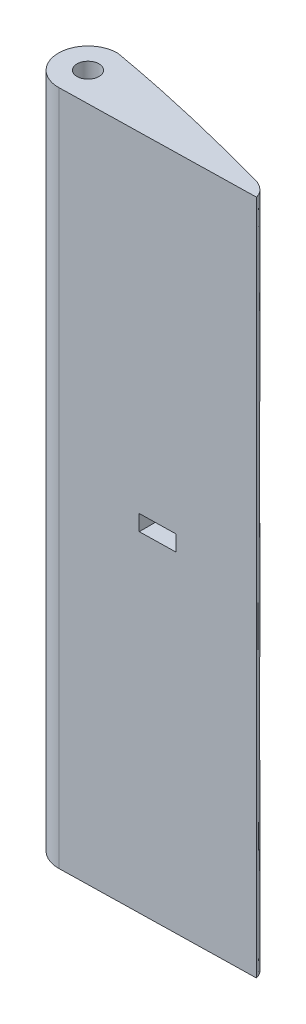
from build123d import *

# Parameters (mm, degrees)
SKETCH1_R           = 1.778
BOSS_EXTRUDE1_DEPTH = 109.22
SKETCH3_W           = 2.921
SKETCH3_H           = 1.27
CUT_EXTRUDE1_DEPTH  = 5.842


with BuildPart() as part:
    # Sketch1 → Boss-Extrude1 (new body)
    with BuildSketch(Plane(origin=(0, 0, 0), x_dir=(1, 0, 0), z_dir=(0, 1, 0))):
        with BuildLine():
            Line((94.902676098, -1.539936949), (126.153699606, -0.905121353))
            add(Edge.make_bspline(
                [(124.23332742, 1.220658438), (125.083825562, 0.793733928), (125.965467473, 0.088202275), (126.153699606, -0.905121353)],
                knots=[0, 0, 0, 0, 1, 1, 1, 1], degree=3))
            add(Edge.make_bspline(
                [(94.805376938, 8.04083585), (104.725661306, 6.284506107), (114.540546966, 3.959935264), (124.23332742, 1.220658438)],
                knots=[0, 0, 0, 0, 1, 1, 1, 1], degree=3))
            ThreePointArc((94.805376938, 8.04083585), (90.01474351, 3.201303292), (94.902676098, -1.539936949))
        make_face()
        with Locations(Location((94.805376938, 3.249955381, 0), (0, 0, 270))):
            Circle(SKETCH1_R, mode=Mode.SUBTRACT)
    extrude(amount=BOSS_EXTRUDE1_DEPTH)

    # Sketch3 → Cut-Extrude1 (cut)
    with BuildSketch(Plane.XY.offset(2.54)):
        with Locations((109.067687852, 55.245)):
            Rectangle(SKETCH3_W, SKETCH3_H)
        with Locations((111.988687852, 55.245)):
            Rectangle(SKETCH3_W, SKETCH3_H)
        with Locations((109.067687852, 53.975)):
            Rectangle(SKETCH3_W, SKETCH3_H)
        with Locations((111.988687852, 53.975)):
            Rectangle(SKETCH3_W, SKETCH3_H)
    extrude(amount=-CUT_EXTRUDE1_DEPTH, mode=Mode.SUBTRACT)


solid = part.part
